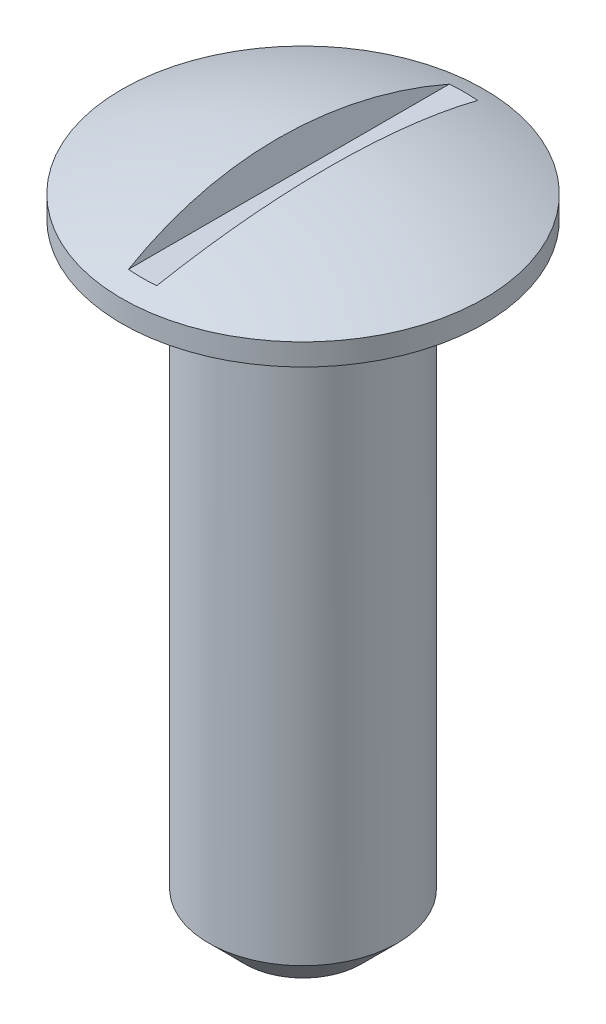
from build123d import *

# Parameters (mm, degrees)
DOME1_FACE_RADIUS       = 0.5
DOME1_HEIGHT            = 0.1
CUT_EXTRUDE2_DEPTH      = 2.173419235
CUT_EXTRUDE2_DEPTH_BACK = 2.173419235
CHAMFER1_SIZE           = 0.1


with BuildPart() as part:
    # Sketch1 → Revolve1 (revolve)
    with BuildSketch(Plane.XY):
        Polygon((0, 0.83643617), (-0.5, 0.83643617), (-0.5, 0.77643617), (-0.26037234, 0.77643617), (-0.26037234, -0.92356383), (0, -0.92356383), align=None)
    revolve(axis=Axis((0, 1.28856383, 0), (0, -1, 0)))

    # Dome1: a dome of height H over a round flat face of radius A is a cap of a sphere of radius (A * A + H * H) / (2 * H)
    dome1_r = (DOME1_FACE_RADIUS * DOME1_FACE_RADIUS + DOME1_HEIGHT * DOME1_HEIGHT) / (2 * DOME1_HEIGHT)
    dome1_base = Plane((0, 0.83643617, 0), z_dir=(0, 1, 0))
    with Locations(dome1_base.offset(DOME1_HEIGHT - dome1_r)):
        dome1_ball = Sphere(dome1_r, mode=Mode.PRIVATE)
    add(split(dome1_ball, bisect_by=dome1_base, keep=Keep.TOP, mode=Mode.PRIVATE))

    # Sketch2 → Cut-Extrude2 (cut, two sides: drawn at the far end of the back side and taken through both)
    with BuildSketch(Plane.XY.offset(-CUT_EXTRUDE2_DEPTH_BACK)):
        Polygon((-5.197321888, 13.839981197), (-0.069398593, 0.934582478), (-0.039027182, 0.858147018), (0.039027182, 0.858147018), (0.069398593, 0.934582478), (5.197321888, 13.839981197), (5.197321888, 41.613703556), (-5.197321888, 41.613703556), align=None)
    extrude(amount=CUT_EXTRUDE2_DEPTH + CUT_EXTRUDE2_DEPTH_BACK, mode=Mode.SUBTRACT)

    # Chamfer1
    chamfer1_edges = [part.edges().sort_by_distance(p)[0] for p in [
        (0.26037234, -0.92356383, 0),
    ]]
    chamfer(chamfer1_edges, length=CHAMFER1_SIZE)


solid = part.part
